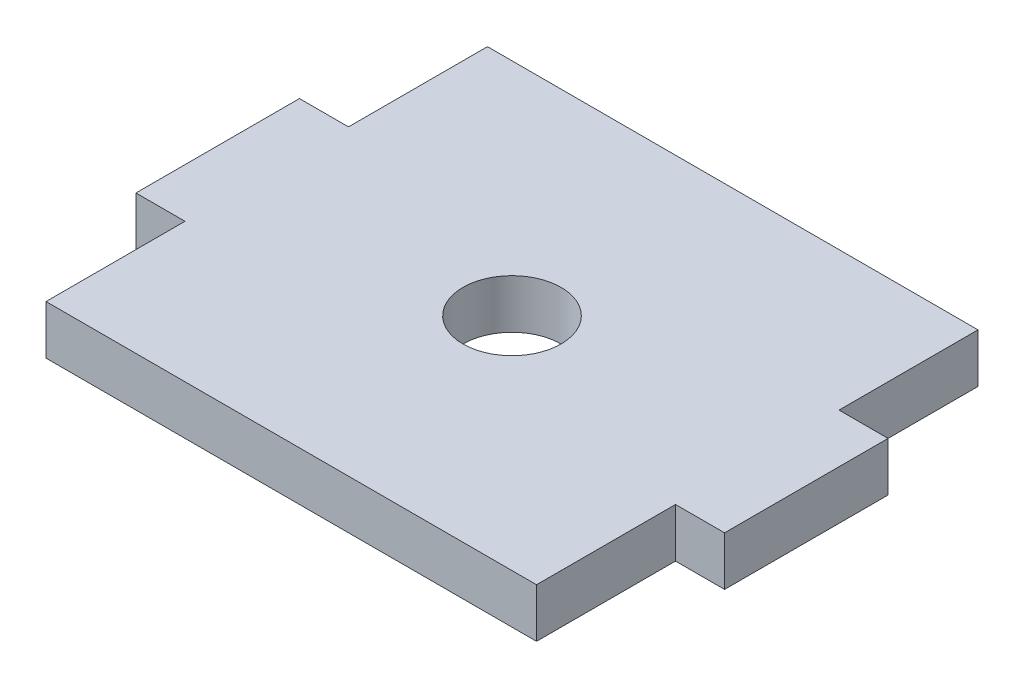
from build123d import *

# Parameters (mm, degrees)
CROQUIS1_R              = 3
SALIENTE_EXTRUIR1_DEPTH = 3


with BuildPart() as part:
    # Croquis1 → Saliente-Extruir1 (new body)
    with BuildSketch(Plane(origin=(0, 0, 0), x_dir=(1, 0, 0), z_dir=(0, 1, 0))):
        Polygon((0, 0), (30, 0), (30, 8.5), (33, 8.5), (33, 13.5), (33, 18.5), (30, 18.5), (30, 27), (0, 27), (0, 18.5), (-3, 18.5), (-3, 13.5), (-3, 8.5), (0, 8.5), align=None)
        with Locations(Location((15, 13.5, 0), (0, 0, 270))):
            Circle(CROQUIS1_R, mode=Mode.SUBTRACT)
    extrude(amount=SALIENTE_EXTRUIR1_DEPTH)


solid = part.part
